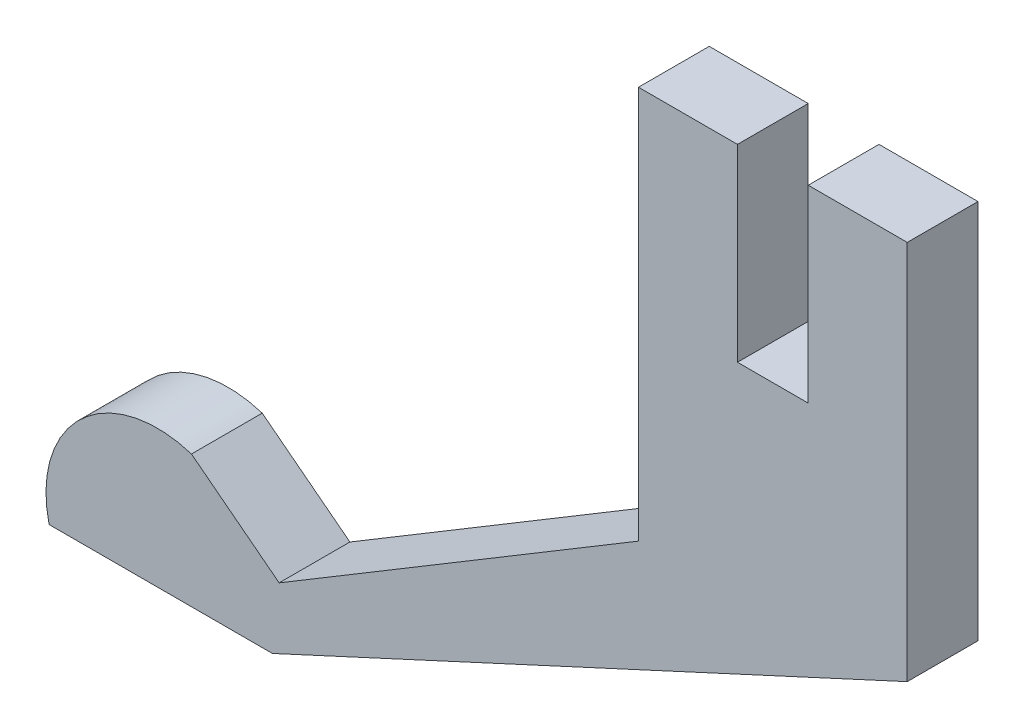
from build123d import *

# Parameters (mm, degrees)
BASE_EXTRUDE_DEPTH = 3


with BuildPart() as part:
    # Sketch1 → Base-Extrude (new body)
    with BuildSketch(Plane.XY):
        with BuildLine():
            Line((680.457626037, 60.260266596), (676.26056061, 60.260266596))
            Line((676.26056061, 60.260266596), (676.26056061, 52.260266596))
            Line((676.26056061, 52.260266596), (673.26056061, 52.260266596))
            Line((673.26056061, 52.260266596), (673.26056061, 60.260266596))
            Line((673.26056061, 60.260266596), (669.063495183, 60.260266596))
            Line((669.063495183, 60.260266596), (669.063495183, 43.594825241))
            Line((669.063495183, 43.594825241), (653.829781186, 34.445934083))
            Line((653.829781186, 34.445934083), (650.112842273, 37.318253557))
            ThreePointArc((650.112842273, 37.318253557), (645.45251291, 36.281643741), (644.078713053, 31.709346327))
            Line((644.078713053, 31.709346327), (653.540593645, 31.709346327))
            Line((653.540593645, 31.709346327), (680.457626037, 44.132301579))
            Line((680.457626037, 44.132301579), (680.457626037, 60.260266596))
        make_face()
    extrude(amount=BASE_EXTRUDE_DEPTH)


solid = part.part
